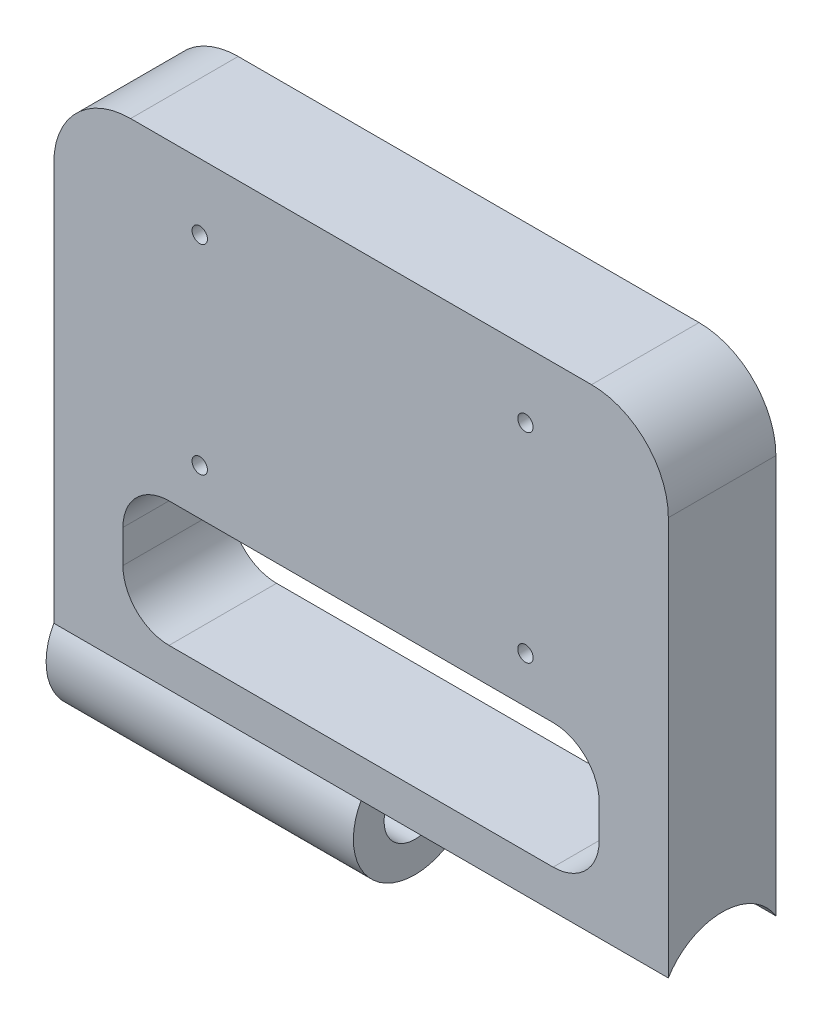
from build123d import *

# Parameters (mm, degrees)
SKETCH1_W                = 40
SKETCH1_H                = 33.082043622
BOSS_EXTRUDE1_DEPTH      = 7
SKETCH2_R                = 4.1
CUT_EXTRUDE1_DEPTH       = 20
BOSS_EXTRUDE2_DEPTH      = 11
BOSS_EXTRUDE2_DEPTH_BACK = 9
SKETCH3_R                = 4
SKETCH3_R_2              = 2
FILLET1_R                = 5
SKETCH4_R                = 0.5
SKETCH4_W                = 31
SKETCH4_H                = 8.146627971
CUT_EXTRUDE2_DEPTH       = 45.095541639
FILLET2_R                = 3
SKETCH5_R                = 2
CUT_EXTRUDE3_DEPTH       = 56.229329833


with BuildPart() as part:
    # Sketch1 → Boss-Extrude1 (new body)
    with BuildSketch(Plane.XY):
        with Locations((-2.229213179, -16.994598242)):
            Rectangle(SKETCH1_W, SKETCH1_H)
    extrude(amount=BOSS_EXTRUDE1_DEPTH)

    # Sketch2 → Cut-Extrude1 (cut)
    with BuildSketch(Plane(origin=(17.770786821, 0, 0), x_dir=(0, 0, -1), z_dir=(1, 0, 0))):
        with Locations((-3.5, -33.535620053)):
            Circle(SKETCH2_R)
    extrude(amount=-CUT_EXTRUDE1_DEPTH, mode=Mode.SUBTRACT)

    # Sketch3 → Boss-Extrude2 (add, two sides: drawn at the far end of the back side and taken through both)
    with BuildSketch(Plane(origin=(-13.229213179, 0, 0), x_dir=(0, 0, -1), z_dir=(1, 0, 0)).offset(-BOSS_EXTRUDE2_DEPTH_BACK)):
        with Locations((-3.5, -33.336696075)):
            Circle(SKETCH3_R)
        with Locations((-3.5, -33.336696075)):
            Circle(SKETCH3_R_2, mode=Mode.SUBTRACT)
    extrude(amount=BOSS_EXTRUDE2_DEPTH + BOSS_EXTRUDE2_DEPTH_BACK)

    # Fillet1
    fillet1_edges = [part.edges().sort_by_distance(p)[0] for p in [
        (-22.229213179, -0.453576431, 3.5),
        (17.770786821, -0.453576431, 3.5),
    ]]
    fillet(fillet1_edges, radius=FILLET1_R)

    # Sketch4 → Cut-Extrude2 (cut, through all)
    with BuildSketch(Plane(origin=(0, 0, 0), x_dir=(-1, 0, 0), z_dir=(0, 0, -1))):
        with Locations((-8.470786821, -4.753576431)):
            Circle(SKETCH4_R)
        with Locations((12.729213179, -4.753576431)):
            Circle(SKETCH4_R)
        with Locations((12.729213179, -17.753576431)):
            Circle(SKETCH4_R)
        with Locations((-8.470786821, -17.753576431)):
            Circle(SKETCH4_R)
        with Locations((2.229213179, -24.826890417)):
            Rectangle(SKETCH4_W, SKETCH4_H)
    extrude(amount=-CUT_EXTRUDE2_DEPTH, mode=Mode.SUBTRACT)

    # Fillet2
    fillet2_edges = [part.edges().sort_by_distance(p)[0] for p in [
        (-17.729213179, -20.753576431, 3.5),
        (-17.729213179, -28.900204402, 3.5),
        (13.270786821, -28.900204402, 3.5),
        (13.270786821, -20.753576431, 3.5),
    ]]
    fillet(fillet2_edges, radius=FILLET2_R)

    # Sketch5 → Cut-Extrude3 (cut, through all)
    with BuildSketch(Plane.ZY.offset(22.229213179)):
        with Locations(Location((3.5, -33.336696075, 0), (0, 0, 90))):
            Circle(SKETCH5_R)
    extrude(amount=-CUT_EXTRUDE3_DEPTH, mode=Mode.SUBTRACT)


solid = part.part
